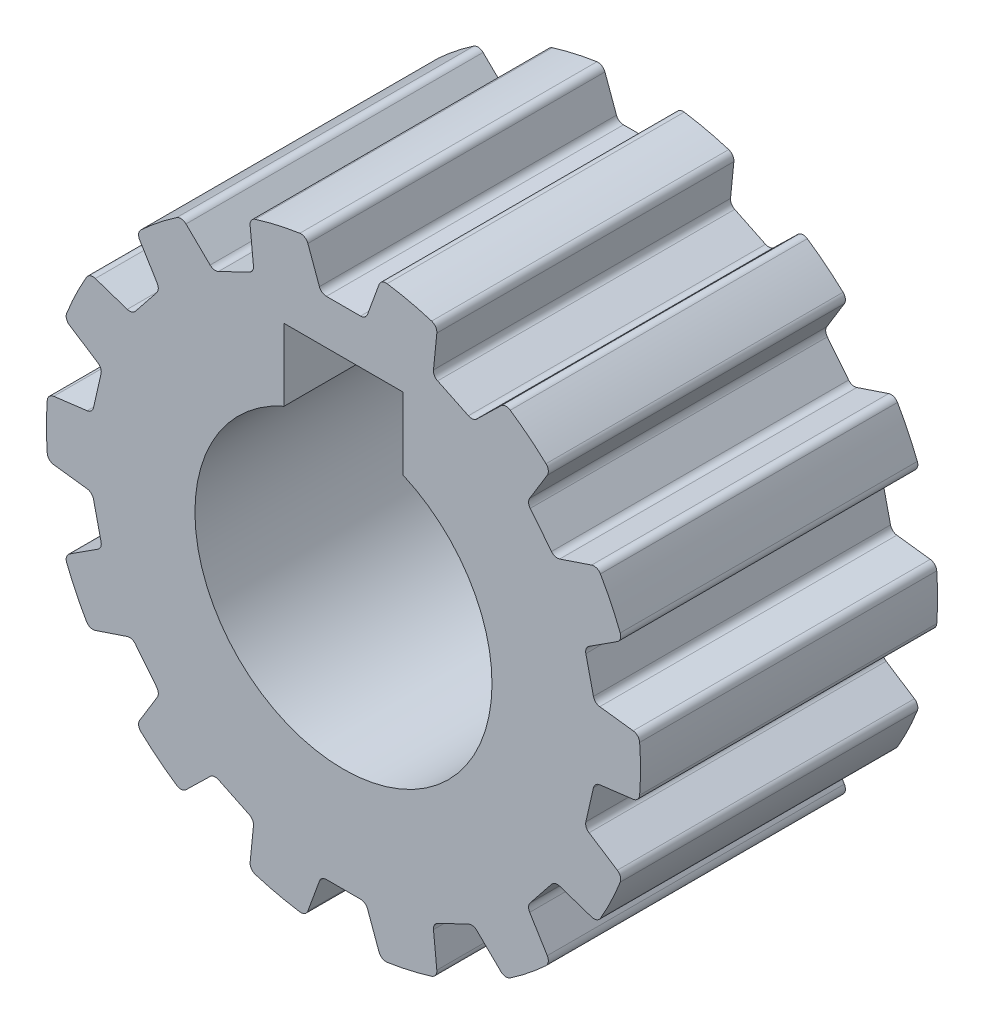
from build123d import *

# Parameters (mm, degrees)
SKETCH1_R           = 10
BOSS_EXTRUDE1_DEPTH = 5
CUT_EXTRUDE1_DEPTH  = 18.320508076
CIRPATTERN1_COUNT   = 14
FILLET1_R           = 0.25


with BuildPart() as part:
    # Sketch1 → Boss-Extrude1 (new, symmetric)
    with BuildSketch(Plane.XY):
        Circle(SKETCH1_R)
        with BuildLine():
            Line((2, 7), (-2, 7))
            Line((-2, 7), (-2, 4.582575695))
            ThreePointArc((-2, 4.582575695), (0, -5), (2, 4.582575695))
            Line((2, 4.582575695), (2, 7))
        make_face(mode=Mode.SUBTRACT)
    extrude(amount=BOSS_EXTRUDE1_DEPTH, both=True)

    # Sketch2 → Cut-Extrude1 (cut, through all)
    with BuildSketch(Plane.XY.offset(5)):
        with BuildLine():
            Line((-0.75, 8.5), (0.75, 8.5))
            Line((0.75, 8.5), (1.266640021, 9.919456792))
            ThreePointArc((1.266640021, 9.919456792), (0, 10.615950068), (-1.266640021, 9.919456792))
            Line((-1.266640021, 9.919456792), (-0.75, 8.5))
        make_face()
    cut_extrude1 = extrude(amount=-CUT_EXTRUDE1_DEPTH, mode=Mode.SUBTRACT)

    # CirPattern1: Cut-Extrude1 ×14 about axis
    cirpattern1_axis = Axis((0, 0, 0), (0, 0, 1))
    for i in range(1, CIRPATTERN1_COUNT):
        add(cut_extrude1.rotate(cirpattern1_axis, i * 360 / CIRPATTERN1_COUNT), mode=Mode.SUBTRACT)

    # Fillet1
    fillet1_edges = [part.edges().sort_by_distance(p)[0] for p in [
        (-6.965606473, 7.174979196, 0),
        (-6.17795025, 5.886036928, 0),
        (-7.113184952, 4.713289704, 0),
        (-8.545080745, 5.194381104, 0),
        (-9.38890138, 3.442169501, 0),
        (-8.119996553, 2.622623873, 0),
        (-8.453777954, 1.160232004, 0),
        (-9.952609221, 0.972404078, 0),
        (-9.952609221, -0.972404078, 0),
        (-8.453777954, -1.160232004, 0),
        (-8.119996553, -2.622623873, 0),
        (-9.38890138, -3.442169501, 0),
        (-8.545080745, -5.194381104, 0),
        (-7.113184952, -4.713289704, 0),
        (-6.17795025, -5.886036928, 0),
        (-6.965606473, -7.174979196, 0),
        (-5.445094229, -8.387547248, 0),
        (-4.363738433, -7.332822573, 0),
        (-3.012285132, -7.983648182, 0),
        (-3.162687777, -9.486696265, 0),
        (-1.266640021, -9.919456792, 0),
        (-0.75, -8.5, 0),
        (0.75, -8.5, 0),
        (1.266640021, -9.919456792, 0),
        (3.162687777, -9.486696265, 0),
        (3.012285132, -7.983648182, 0),
        (4.363738433, -7.332822573, 0),
        (5.445094229, -8.387547248, 0),
        (6.965606473, -7.174979196, 0),
        (6.17795025, -5.886036928, 0),
        (7.113184952, -4.713289704, 0),
        (8.545080745, -5.194381104, 0),
        (9.38890138, -3.442169501, 0),
        (8.119996553, -2.622623873, 0),
        (8.453777954, -1.160232004, 0),
        (9.952609221, -0.972404078, 0),
        (9.952609221, 0.972404078, 0),
        (8.453777954, 1.160232004, 0),
        (8.119996553, 2.622623873, 0),
        (9.38890138, 3.442169501, 0),
        (8.545080745, 5.194381104, 0),
        (7.113184952, 4.713289704, 0),
        (6.17795025, 5.886036928, 0),
        (6.965606473, 7.174979196, 0),
        (5.445094229, 8.387547248, 0),
        (4.363738433, 7.332822573, 0),
        (3.012285132, 7.983648182, 0),
        (3.162687777, 9.486696265, 0),
        (-3.162687777, 9.486696265, 0),
        (-3.012285132, 7.983648182, 0),
        (-4.363738433, 7.332822573, 0),
        (-5.445094229, 8.387547248, 0),
        (1.266640021, 9.919456792, 0),
        (0.75, 8.5, 0),
        (-0.75, 8.5, 0),
        (-1.266640021, 9.919456792, 0),
    ]]
    fillet(fillet1_edges, radius=FILLET1_R)


solid = part.part
